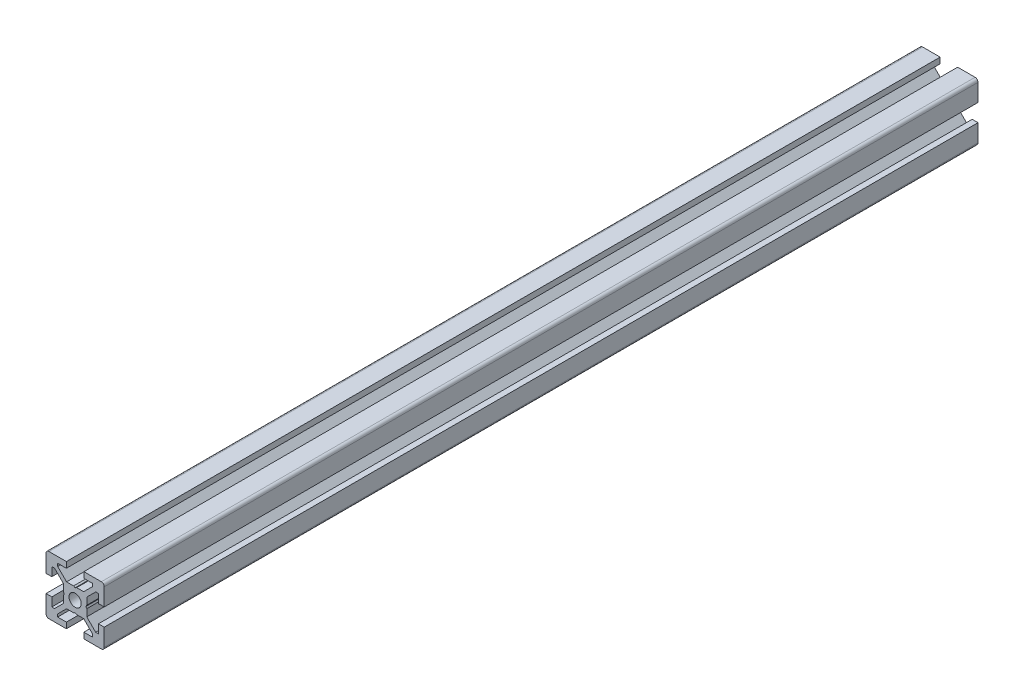
from build123d import *

# Parameters (mm, degrees)
SKETCH1_R           = 2.1
BOSS_EXTRUDE1_DEPTH = 300


with BuildPart() as part:
    # Sketch1 → Boss-Extrude1 (new body)
    with BuildSketch(Plane(origin=(0, 0, -340), x_dir=(-1, 0, 0), z_dir=(0, 0, -1))):
        with BuildLine():
            Line((10, -3), (8, -3))
            Line((8, -3), (8, -6))
            Line((8, -6), (7.060660172, -6))
            Line((7.060660172, -6), (4, -2.939339828))
            Line((4, -2.939339828), (4, -0.519615242))
            Line((4, -0.519615242), (3.7, 0))
            Line((3.7, 0), (4, 0.519615242))
            Line((4, 0.519615242), (4, 2.939339828))
            Line((4, 2.939339828), (7.060660172, 6))
            Line((7.060660172, 6), (8, 6))
            Line((8, 6), (8, 3))
            Line((8, 3), (10, 3))
            Line((10, 3), (10, 9))
            ThreePointArc((10, 9), (9.707106781, 9.707106781), (9, 10))
            Line((9, 10), (3, 10))
            Line((3, 10), (3, 8))
            Line((3, 8), (6, 8))
            Line((6, 8), (6, 7.060660172))
            Line((6, 7.060660172), (2.939339828, 4))
            Line((2.939339828, 4), (0.519615242, 4))
            Line((0.519615242, 4), (0, 3.7))
            Line((0, 3.7), (-0.519615242, 4))
            Line((-0.519615242, 4), (-2.939339828, 4))
            Line((-2.939339828, 4), (-6, 7.060660172))
            Line((-6, 7.060660172), (-6, 8))
            Line((-6, 8), (-3, 8))
            Line((-3, 8), (-3, 10))
            Line((-3, 10), (-9, 10))
            ThreePointArc((-9, 10), (-9.707106781, 9.707106781), (-10, 9))
            Line((-10, 9), (-10, 3))
            Line((-10, 3), (-8, 3))
            Line((-8, 3), (-8, 6))
            Line((-8, 6), (-7.060660172, 6))
            Line((-7.060660172, 6), (-4, 2.939339828))
            Line((-4, 2.939339828), (-4, 0.519615242))
            Line((-4, 0.519615242), (-3.7, 0))
            Line((-3.7, 0), (-4, -0.519615242))
            Line((-4, -0.519615242), (-4, -2.939339828))
            Line((-4, -2.939339828), (-7.060660172, -6))
            Line((-7.060660172, -6), (-8, -6))
            Line((-8, -6), (-8, -3))
            Line((-8, -3), (-10, -3))
            Line((-10, -3), (-10, -9))
            ThreePointArc((-10, -9), (-9.707106781, -9.707106781), (-9, -10))
            Line((-9, -10), (-3, -10))
            Line((-3, -10), (-3, -8))
            Line((-3, -8), (-6, -8))
            Line((-6, -8), (-6, -7.060660172))
            Line((-6, -7.060660172), (-2.939339828, -4))
            Line((-2.939339828, -4), (-0.519615242, -4))
            Line((-0.519615242, -4), (0, -3.7))
            Line((0, -3.7), (0.519615242, -4))
            Line((0.519615242, -4), (2.939339828, -4))
            Line((2.939339828, -4), (6, -7.060660172))
            Line((6, -7.060660172), (6, -8))
            Line((6, -8), (3, -8))
            Line((3, -8), (3, -10))
            Line((3, -10), (9, -10))
            ThreePointArc((9, -10), (9.707106781, -9.707106781), (10, -9))
            Line((10, -9), (10, -3))
        make_face()
        with Locations(Location((0, 0, 0), (0, 0, 180))):
            Circle(SKETCH1_R, mode=Mode.SUBTRACT)
    extrude(amount=-BOSS_EXTRUDE1_DEPTH)


solid = part.part
